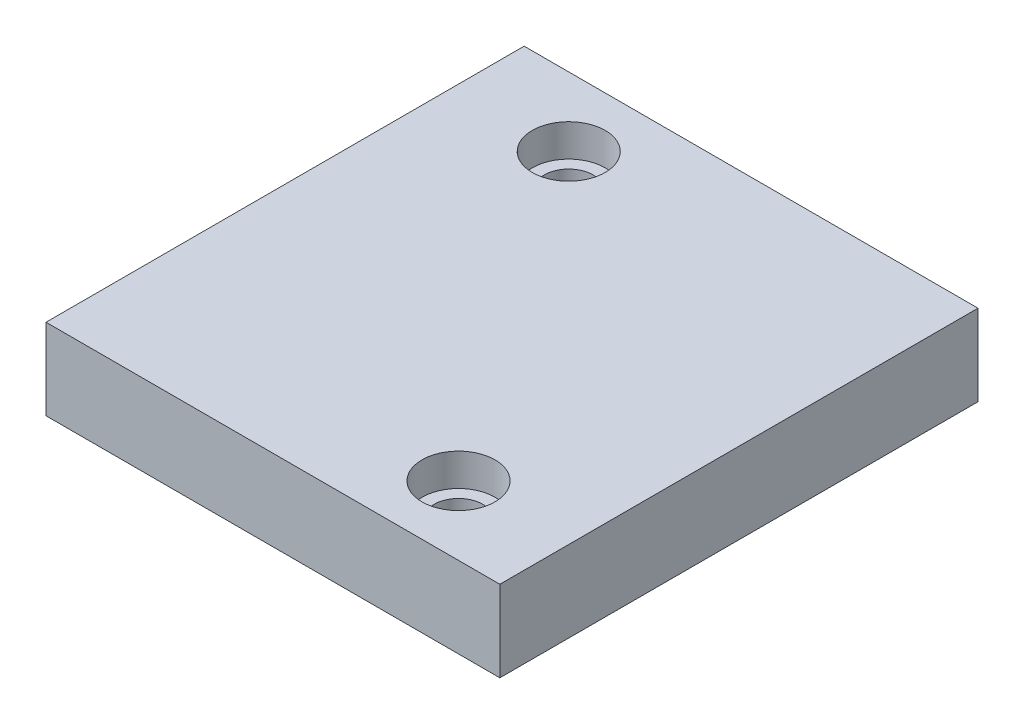
from build123d import *

# Parameters (mm, degrees)
SKETCH_1_W          = 28
SKETCH_1_H          = 29.5
EXTRUDE_1_DEPTH     = 5
SKETCH_1_20_R       = 1.5
CUT_EXTRUDE_1_DEPTH = 41.978652979
CUT_EXTRUDE_START   = 5
SKETCH_1_21_R       = 2.25
CUT_EXTRUDE_2_DEPTH = 2
SKETCH_4_R          = 1
CUT_EXTRUDE_3_DEPTH = 4


with BuildPart() as part:
    # 草图1 → 凸台-拉伸1 (new body)
    with BuildSketch(Plane(origin=(0, 0, 0), x_dir=(1, 0, 0), z_dir=(0, 1, 0))):
        with Locations((-14, -14.75)):
            Rectangle(SKETCH_1_W, SKETCH_1_H)
    extrude(amount=EXTRUDE_1_DEPTH)

    # 草图1<20> → 切除-拉伸1 (cut, through all)
    with BuildSketch(Plane(origin=(0, 0, 0), x_dir=(1, 0, 0), z_dir=(0, 1, 0))):
        with Locations(Location((-21, -4.25, 0), (0, 0, 270))):
            Circle(SKETCH_1_20_R)
        with Locations(Location((-6.8, -25.25, 0), (0, 0, 270))):
            Circle(SKETCH_1_20_R)
    extrude(amount=CUT_EXTRUDE_1_DEPTH, mode=Mode.SUBTRACT)

    # 草图1<21> → 切除-拉伸2 (cut)
    with BuildSketch(Plane(origin=(0, 0, 0), x_dir=(1, 0, 0), z_dir=(0, 1, 0)).offset(CUT_EXTRUDE_START)):
        with Locations(Location((-21, -4.25, 0), (0, 0, 270))):
            Circle(SKETCH_1_21_R)
        with Locations(Location((-6.8, -25.25, 0), (0, 0, 270))):
            Circle(SKETCH_1_21_R)
    extrude(amount=-CUT_EXTRUDE_2_DEPTH, mode=Mode.SUBTRACT)

    # 草图4 → 切除-拉伸3 (cut)
    with BuildSketch(Plane.ZY.offset(28)):
        with Locations((10, 2.5)):
            Circle(SKETCH_4_R)
        with Locations((24.5, 2.5)):
            Circle(SKETCH_4_R)
    extrude(amount=-CUT_EXTRUDE_3_DEPTH, mode=Mode.SUBTRACT)


solid = part.part
